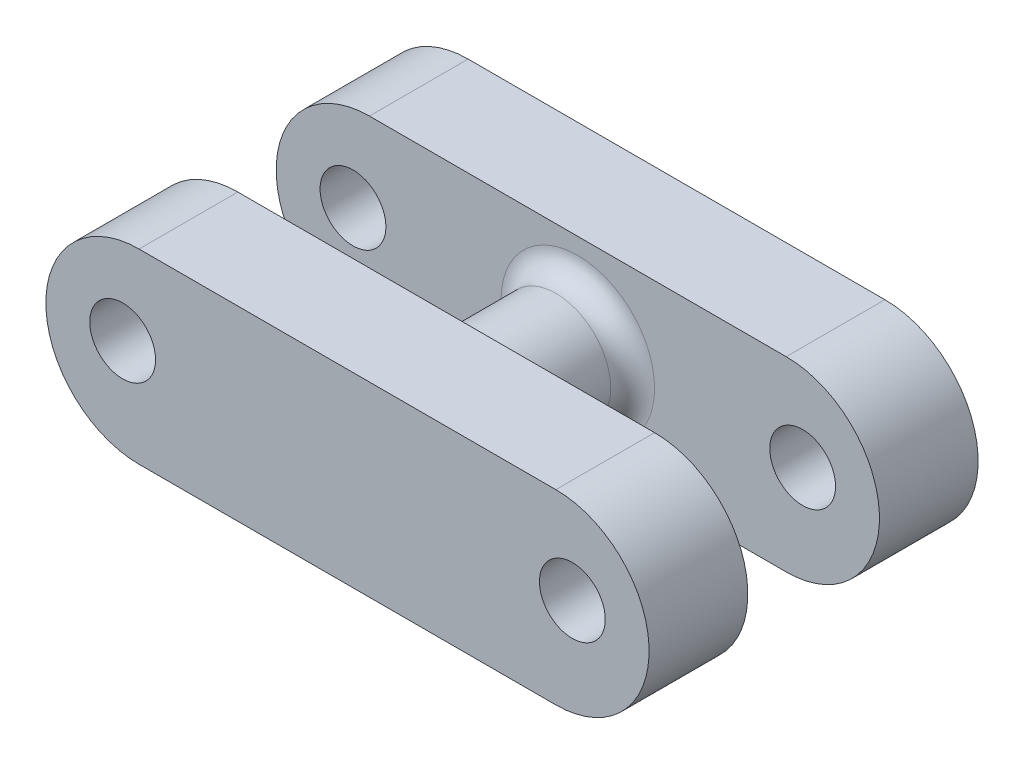
from build123d import *

# Parameters (mm, degrees)
SZKIC1_R                    = 3
DODANIE_WYCI_GNI_CIE1_DEPTH = 30
SZKIC2_W                    = 12
SZKIC2_H                    = 17
WYTNIJ_WYCI_GNI_CIE1_DEPTH  = 65.915329468
SZKIC3_R                    = 5
DODANIE_WYCI_GNI_CIE2_DEPTH = 30
ZAOKR_GLENIE3_R             = 2
ZAOKR_GLENIE6_RADIUS        = 8.5
ZAOKR_GLENIE6_LENGTH        = 9
ZAOKR_GLENIE7_RADIUS        = 8.5
ZAOKR_GLENIE7_LENGTH        = 9
ZAOKR_GLENIE8_RADIUS        = 8.5
ZAOKR_GLENIE8_LENGTH        = 9
ZAOKR_GLENIE9_RADIUS        = 8.5
ZAOKR_GLENIE9_LENGTH        = 9


with BuildPart() as part:
    # Szkic1 → Dodanie-wyciągnięcie1 (new body)
    with BuildSketch(Plane.XY):
        Polygon((0, 0), (0, 17), (55, 17), (55, 0), (10, 0), align=None)
        with Locations((48, 9)):
            Circle(SZKIC1_R, mode=Mode.SUBTRACT)
        with Locations((7, 9)):
            Circle(SZKIC1_R, mode=Mode.SUBTRACT)
    extrude(amount=DODANIE_WYCI_GNI_CIE1_DEPTH)

    # Szkic2 → Wytnij-wyciągnięcie1 (cut, through all)
    with BuildSketch(Plane(origin=(55, 0, 0), x_dir=(0, 0, -1), z_dir=(1, 0, 0))):
        with Locations((-15, 8.5)):
            Rectangle(SZKIC2_W, SZKIC2_H)
    extrude(amount=-WYTNIJ_WYCI_GNI_CIE1_DEPTH, mode=Mode.SUBTRACT)


with BuildPart() as wytnij_wyci_gni_cie1_piece_1:
    # of the separate pieces the step leaves, piece 1, a body of its own (wytnij_wyci_gni_cie1_pieces)
    add(part.part.solids().sort_by_distance((0, 0, 21))[0])



with BuildPart() as wytnij_wyci_gni_cie1_piece_2:
    # of the separate pieces the step leaves, piece 2, a body of its own (wytnij_wyci_gni_cie1_pieces)
    add(part.part.solids().sort_by_distance((0, 0, 0))[0])


with BuildPart() as wytnij_wyci_gni_cie1_piece_1_1:
    add(wytnij_wyci_gni_cie1_piece_1.part)

    add(wytnij_wyci_gni_cie1_piece_2.part)  # Dodanie-wyciągnięcie2 merges Wytnij-wyciągnięcie1 piece 2
    # Szkic3 → Dodanie-wyciągnięcie2 (add)
    with BuildSketch(Plane(origin=(0, 0, 0), x_dir=(-1, 0, 0), z_dir=(0, 0, -1))):
        with Locations((-27.5, 8.5)):
            Circle(SZKIC3_R)
    extrude(amount=-DODANIE_WYCI_GNI_CIE2_DEPTH)

    # Zaokrąglenie3
    zaokr_glenie3_edges = [wytnij_wyci_gni_cie1_piece_1_1.edges().sort_by_distance(p)[0] for p in [
        (32.5, 8.5, 9),
        (32.5, 8.5, 21),
    ]]
    fillet(zaokr_glenie3_edges, radius=ZAOKR_GLENIE3_R)

    # Zaokrąglenie6: full round fillet: the end face becomes a half cylinder, R = half its width
    zaokr_glenie6_face = Plane((55, 8.5, 4.5), x_dir=(0, 0, 1), z_dir=(1, 0, 0))  # on the end face: x along it, z out of the body
    zaokr_glenie6_slab = zaokr_glenie6_face.offset(-ZAOKR_GLENIE6_RADIUS / 2) * Box(ZAOKR_GLENIE6_LENGTH, 2 * ZAOKR_GLENIE6_RADIUS, ZAOKR_GLENIE6_RADIUS, mode=Mode.PRIVATE)  # the body's end, R deep
    zaokr_glenie6_round = Plane((46.5, 8.5, 4.5), x_dir=(1, 0, 0), z_dir=(0, 0, 1)) * Cylinder(ZAOKR_GLENIE6_RADIUS, ZAOKR_GLENIE6_LENGTH, mode=Mode.PRIVATE)  # its axis R under the face
    add(zaokr_glenie6_slab - zaokr_glenie6_round, mode=Mode.SUBTRACT)

    # Zaokrąglenie7: full round fillet: the end face becomes a half cylinder, R = half its width
    zaokr_glenie7_face = Plane((55, 8.5, 25.5), x_dir=(0, 0, 1), z_dir=(1, 0, 0))  # on the end face: x along it, z out of the body
    zaokr_glenie7_slab = zaokr_glenie7_face.offset(-ZAOKR_GLENIE7_RADIUS / 2) * Box(ZAOKR_GLENIE7_LENGTH, 2 * ZAOKR_GLENIE7_RADIUS, ZAOKR_GLENIE7_RADIUS, mode=Mode.PRIVATE)  # the body's end, R deep
    zaokr_glenie7_round = Plane((46.5, 8.5, 25.5), x_dir=(1, 0, 0), z_dir=(0, 0, 1)) * Cylinder(ZAOKR_GLENIE7_RADIUS, ZAOKR_GLENIE7_LENGTH, mode=Mode.PRIVATE)  # its axis R under the face
    add(zaokr_glenie7_slab - zaokr_glenie7_round, mode=Mode.SUBTRACT)

    # Zaokrąglenie8: full round fillet: the end face becomes a half cylinder, R = half its width
    zaokr_glenie8_face = Plane((0, 8.5, 4.5), x_dir=(0, 0, 1), z_dir=(-1, 0, 0))  # on the end face: x along it, z out of the body
    zaokr_glenie8_slab = zaokr_glenie8_face.offset(-ZAOKR_GLENIE8_RADIUS / 2) * Box(ZAOKR_GLENIE8_LENGTH, 2 * ZAOKR_GLENIE8_RADIUS, ZAOKR_GLENIE8_RADIUS, mode=Mode.PRIVATE)  # the body's end, R deep
    zaokr_glenie8_round = Plane((8.5, 8.5, 4.5), x_dir=(-1, 0, 0), z_dir=(0, 0, 1)) * Cylinder(ZAOKR_GLENIE8_RADIUS, ZAOKR_GLENIE8_LENGTH, mode=Mode.PRIVATE)  # its axis R under the face
    add(zaokr_glenie8_slab - zaokr_glenie8_round, mode=Mode.SUBTRACT)

    # Zaokrąglenie9: full round fillet: the end face becomes a half cylinder, R = half its width
    zaokr_glenie9_face = Plane((0, 8.5, 25.5), x_dir=(0, 0, -1), z_dir=(-1, 0, 0))  # on the end face: x along it, z out of the body
    zaokr_glenie9_slab = zaokr_glenie9_face.offset(-ZAOKR_GLENIE9_RADIUS / 2) * Box(ZAOKR_GLENIE9_LENGTH, 2 * ZAOKR_GLENIE9_RADIUS, ZAOKR_GLENIE9_RADIUS, mode=Mode.PRIVATE)  # the body's end, R deep
    zaokr_glenie9_round = Plane((8.5, 8.5, 25.5), x_dir=(-1, 0, 0), z_dir=(0, 0, -1)) * Cylinder(ZAOKR_GLENIE9_RADIUS, ZAOKR_GLENIE9_LENGTH, mode=Mode.PRIVATE)  # its axis R under the face
    add(zaokr_glenie9_slab - zaokr_glenie9_round, mode=Mode.SUBTRACT)


solid = wytnij_wyci_gni_cie1_piece_1_1.part
